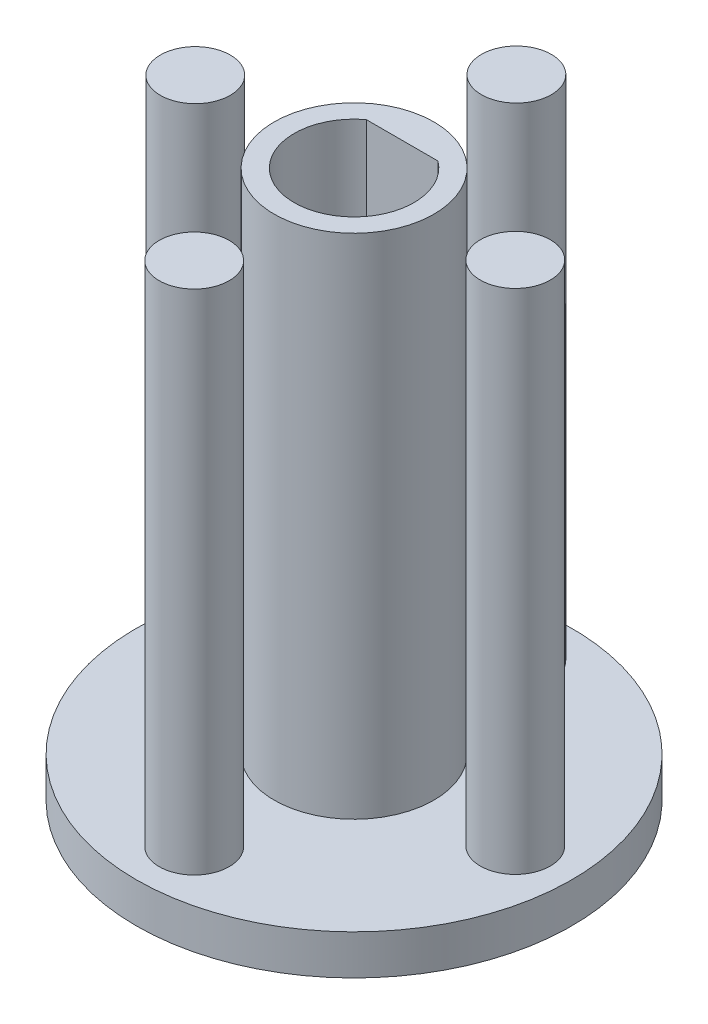
from build123d import *

# Parameters (mm, degrees)
SKETCH3_R             = 1.75
BOSS_EXTRUDE3_DEPTH   = 27.4
BOSS_EXTRUDE3_2_DEPTH = 27.4
BOSS_EXTRUDE3_3_DEPTH = 27.4
BOSS_EXTRUDE3_4_DEPTH = 27.4
SKETCH3_R_2           = 4
BOSS_EXTRUDE3_5_DEPTH = 27.4
SKETCH3_19_R          = 10.9
BOSS_EXTRUDE4_DEPTH   = 2


with BuildPart() as part:
    # Sketch3 → Boss-Extrude3 (new body)
    with BuildSketch(Plane(origin=(0, 0, 0), x_dir=(1, 0, 0), z_dir=(0, 1, 0))):
        with Locations((0.009034474, 8.115584077)):
            Circle(SKETCH3_R)
    extrude(amount=BOSS_EXTRUDE3_DEPTH)



with BuildPart() as body_2:
    # Sketch3 → Boss-Extrude3 2 (new body)
    with BuildSketch(Plane(origin=(0, 0, 0), x_dir=(1, 0, 0), z_dir=(0, 1, 0))):
        with Locations((8.017679827, 0.053335715)):
            Circle(SKETCH3_R)
    extrude(amount=BOSS_EXTRUDE3_2_DEPTH)


with BuildPart() as body_3:
    # Sketch3 → Boss-Extrude3 3 (new body)
    with BuildSketch(Plane(origin=(0, 0, 0), x_dir=(1, 0, 0), z_dir=(0, 1, 0))):
        with Locations((0.009179949, -8.009057152)):
            Circle(SKETCH3_R)
    extrude(amount=BOSS_EXTRUDE3_3_DEPTH)


with BuildPart() as body_4:
    # Sketch3 → Boss-Extrude3 4 (new body)
    with BuildSketch(Plane(origin=(0, 0, 0), x_dir=(1, 0, 0), z_dir=(0, 1, 0))):
        with Locations((-7.999465404, 0.05319121)):
            Circle(SKETCH3_R)
    extrude(amount=BOSS_EXTRUDE3_4_DEPTH)


with BuildPart() as body_5:
    # Sketch3 → Boss-Extrude3 5 (new body)
    with BuildSketch(Plane(origin=(0, 0, 0), x_dir=(1, 0, 0), z_dir=(0, 1, 0))):
        Circle(SKETCH3_R_2)
        with BuildLine():
            Line((-1.793211485, 2.405076417), (1.793211485, 2.405076417))
            ThreePointArc((1.793211485, 2.405076417), (0, -3), (-1.793211485, 2.405076417))
        make_face(mode=Mode.SUBTRACT)
    extrude(amount=BOSS_EXTRUDE3_5_DEPTH)


with BuildPart() as part_1:
    add(part.part)

    add(body_2.part)  # Boss-Extrude4 merges body 2

    add(body_3.part)  # Boss-Extrude4 merges body 3

    add(body_4.part)  # Boss-Extrude4 merges body 4

    add(body_5.part)  # Boss-Extrude4 merges body 5
    # Sketch3<19> → Boss-Extrude4 (add)
    with BuildSketch(Plane(origin=(0, 0, 0), x_dir=(1, 0, 0), z_dir=(0, 1, 0))):
        Circle(SKETCH3_19_R)
    extrude(amount=BOSS_EXTRUDE4_DEPTH)


solid = part_1.part
